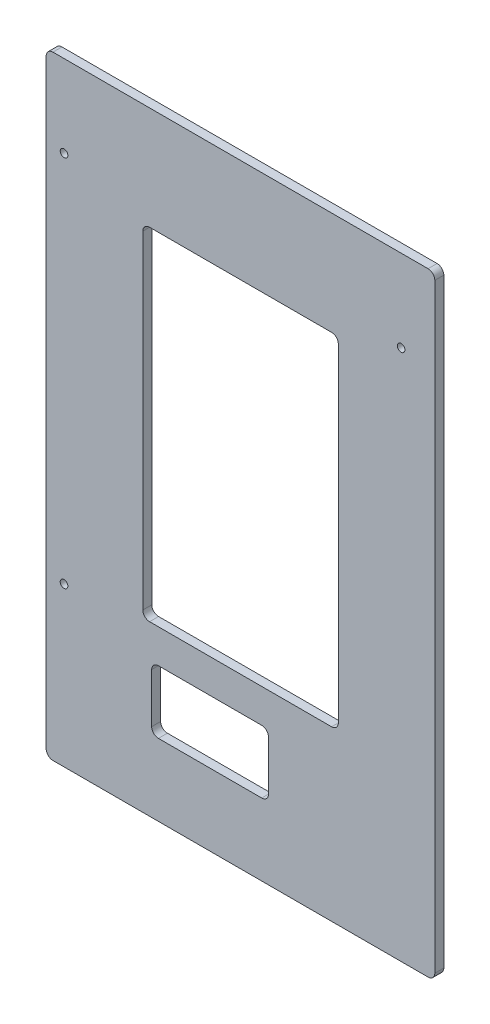
from build123d import *

# Parameters (mm, degrees)
ESQUISSE1_W        = 172.93
ESQUISSE1_H        = 273
ESQUISSE1_R        = 1.5
ESQUISSE1_W_2      = 87
ESQUISSE1_H_2      = 152
ESQUISSE1_W_3      = 52
ESQUISSE1_H_3      = 28
BOSS_EXTRU_1_DEPTH = 4
CONG_1_R           = 3
D_GAGEMENT_M31_D   = 3.4


with BuildPart() as part:
    # Esquisse1 → Boss.-Extru.1 (new body)
    with BuildSketch(Plane.XY):
        with Locations((86.465, 136.5)):
            Rectangle(ESQUISSE1_W, ESQUISSE1_H)
        with Locations((7.93, 236.5)):
            Circle(ESQUISSE1_R, mode=Mode.SUBTRACT)
        with Locations((7.93, 70.5)):
            Circle(ESQUISSE1_R, mode=Mode.SUBTRACT)
        with Locations((157.93, 236.5)):
            Circle(ESQUISSE1_R, mode=Mode.SUBTRACT)
        with Locations((86.5, 151)):
            Rectangle(ESQUISSE1_W_2, ESQUISSE1_H_2, mode=Mode.SUBTRACT)
        with Locations((72.93, 46)):
            Rectangle(ESQUISSE1_W_3, ESQUISSE1_H_3, mode=Mode.SUBTRACT)
    extrude(amount=BOSS_EXTRU_1_DEPTH)

    # Congé1
    cong_1_edges = [part.edges().sort_by_distance(p)[0] for p in [
        (43, 227, 2),
        (43, 75, 2),
        (130, 75, 2),
        (130, 227, 2),
        (46.93, 60, 2),
        (46.93, 32, 2),
        (98.93, 32, 2),
        (98.93, 60, 2),
        (0, 273, 2),
        (172.93, 273, 2),
        (172.93, 0, 2),
        (0, 0, 2),
    ]]
    fillet(cong_1_edges, radius=CONG_1_R)

    # Dégagement M31 (through all)
    with Locations(Plane.XY.offset(4)):
        with Locations((7.93, 236.5), (7.93, 70.5), (157.93, 236.5)):
            Hole(D_GAGEMENT_M31_D / 2)


solid = part.part
